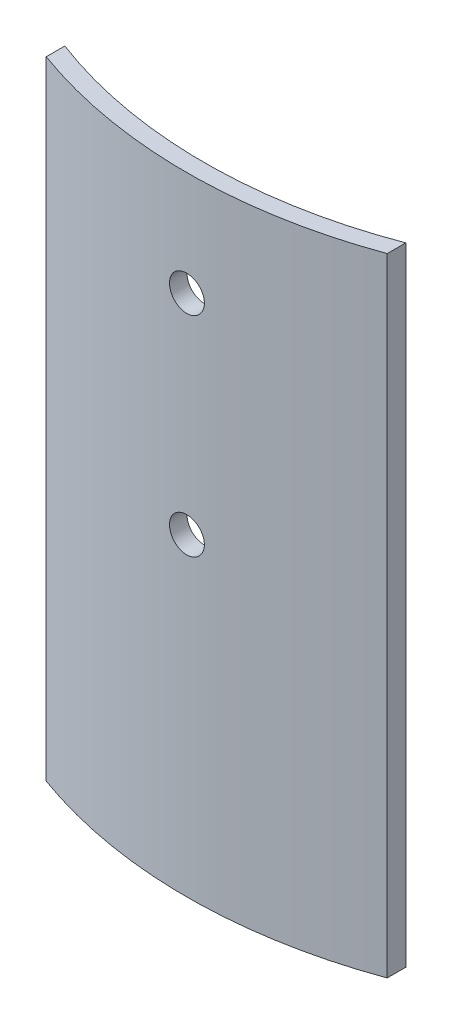
from build123d import *

# Parameters (mm, degrees)
BOSS_EXTRUDE9_DEPTH = 90
SKETCH17_R          = 2.5
CUT_EXTRUDE1_DEPTH  = 5


with BuildPart() as part:
    # Sketch1 → Boss-Extrude9 (new body)
    with BuildSketch(Plane(origin=(0, 0, 0), x_dir=(1, 0, 0), z_dir=(0, 1, 0))):
        with BuildLine():
            ThreePointArc((-10, -68.271516755), (-17.330093713, -66.788231388), (-24.456600104, -64.520343391))
            Line((-24.456600104, -64.520343391), (-24.456600104, -67.187236223))
            ThreePointArc((-24.456600104, -67.187236223), (0, -71.5), (24.456600104, -67.187236223))
            Line((24.456600104, -67.187236223), (24.456600104, -64.520343391))
            ThreePointArc((24.456600104, -64.520343391), (17.330093713, -66.788231388), (10, -68.271516755))
            ThreePointArc((10, -68.271516755), (0, -69), (-10, -68.271516755))
        make_face()
    extrude(amount=BOSS_EXTRUDE9_DEPTH)

    # Sketch17 → Cut-Extrude1 (cut, symmetric)
    with BuildSketch(Plane.XY.offset(67.187236223)):
        with Locations((0, 75)):
            Circle(SKETCH17_R)
        with Locations((0, 45)):
            Circle(SKETCH17_R)
    extrude(amount=CUT_EXTRUDE1_DEPTH, both=True, mode=Mode.SUBTRACT)


solid = part.part
